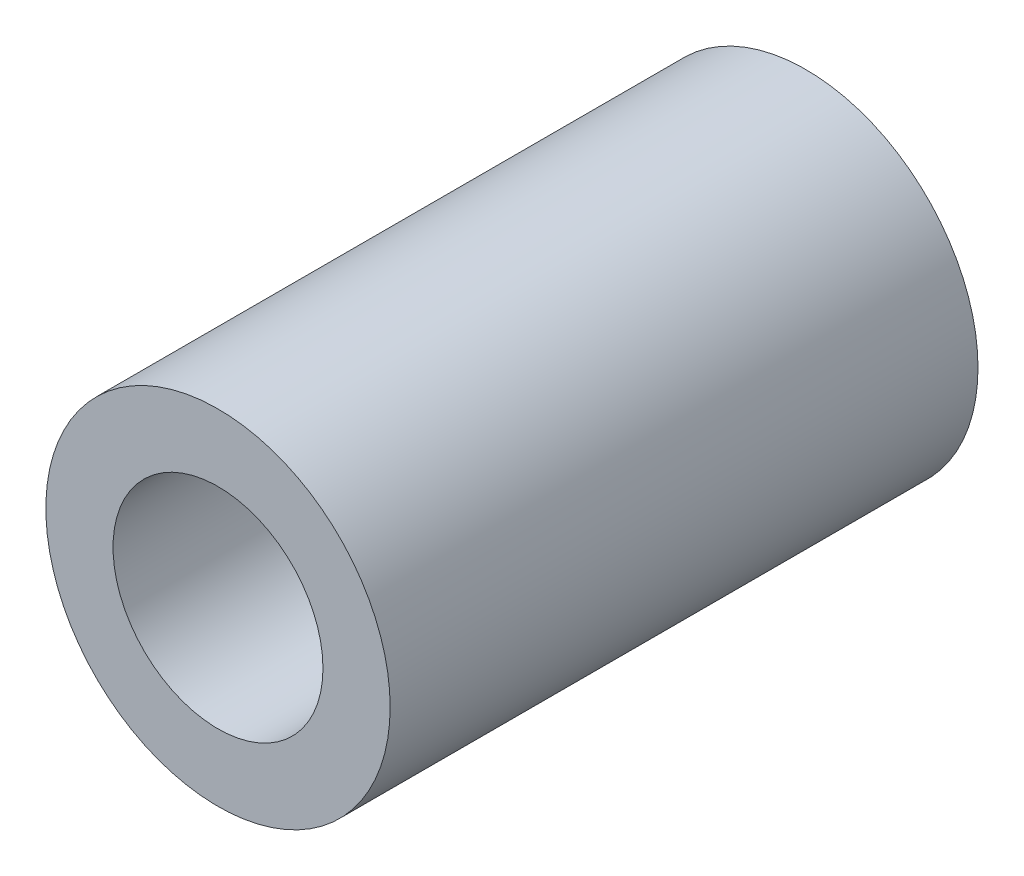
from build123d import *

# Parameters (mm, degrees)
SKETCH1_R           = 20.5
SKETCH1_R_2         = 12.5
BOSS_EXTRUDE1_DEPTH = 70


with BuildPart() as part:
    # Sketch1 → Boss-Extrude1 (new body)
    with BuildSketch(Plane.XY):
        Circle(SKETCH1_R)
        Circle(SKETCH1_R_2, mode=Mode.SUBTRACT)
    extrude(amount=BOSS_EXTRUDE1_DEPTH)


solid = part.part
